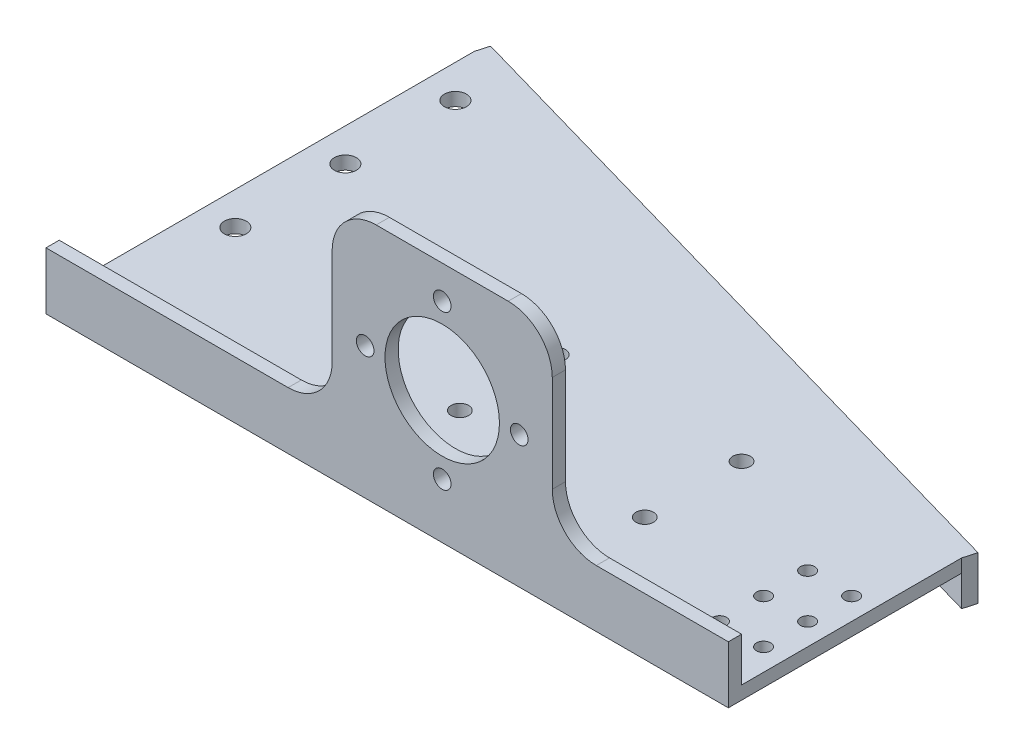
from build123d import *

# Parameters (mm, degrees)
EXTRUDE_1_DEPTH             = 3
HOLE_WIZARD_5_0_5_2_D       = 5
HOLE_WIZARD_3_2_3_2_2_D     = 3.2
PATTERN_LINEAR_1_COUNT      = 3
PATTERN_LINEAR_1_PITCH      = 10
PATTERN_LINEAR_1_COUNT_DIR2 = 2
PATTERN_LINEAR_1_PITCH_DIR2 = 10
EXTRUDE_2_DEPTH             = 10
SKETCH_9_W                  = 155
SKETCH_9_H                  = 3
EXTRUDE_3_DEPTH             = 13
SKETCH_10_W                 = 50
SKETCH_10_H                 = 3
EXTRUDE_4_DEPTH             = 55
SKETCH_12_R                 = 13
CUT_EXTRUDE_1_DEPTH         = 3
SKETCH_13_R                 = 2
CUT_EXTRUDE_2_DEPTH         = 3
PATTERN_CIRCULAR_1_COUNT    = 4
FILLET_1_R                  = 10
HOLE_WIZARD_4_0_4_2_D       = 4


with BuildPart() as part:
    # 草图1 → 凸台-拉伸1 (new body)
    with BuildSketch(Plane(origin=(0, 0, 0), x_dir=(1, 0, 0), z_dir=(0, 1, 0))):
        Polygon((-85, -45), (70, -45), (70, 5), (-70, 45), (-85, 45), align=None)
        Polygon((-85, 45), (-70, 45), (-85, 49.285714286), align=None)
    extrude(amount=EXTRUDE_1_DEPTH)

    # Ø5.0 (5) 直径孔2 (through all)
    with Locations(Plane(origin=(0, 3, 0), x_dir=(1, 0, 0), z_dir=(0, 1, 0))):
        with Locations((-77.5, -37.5), (-77.5, -12.5), (-77.5, 37.5), (-77.5, 12.5)):
            Hole(HOLE_WIZARD_5_0_5_2_D / 2)

    # Ø3.2 (3.2) 直径孔2 (through all)
    with Locations(Plane(origin=(0, 0, 0), x_dir=(-1, 0, 0), z_dir=(0, -1, 0))):
        with Locations((-65, -35)):
            hole_wizard_3_2_3_2_2 = Hole(HOLE_WIZARD_3_2_3_2_2_D / 2)

    # 阵列(线性)1: Hole Wizard 3.2 _3.2_ _2 3 × 2
    with Locations(*[(-j * PATTERN_LINEAR_1_PITCH_DIR2, 0, -i * PATTERN_LINEAR_1_PITCH) for i in range(PATTERN_LINEAR_1_COUNT) for j in range(PATTERN_LINEAR_1_COUNT_DIR2) if (i, j) != (0, 0)]):
        add(hole_wizard_3_2_3_2_2, mode=Mode.SUBTRACT)

    # 草图8 → 凸台-拉伸2 (add)
    with BuildSketch(Plane(origin=(0, 3, 0), x_dir=(1, 0, 0), z_dir=(0, 1, 0))):
        Polygon((-85, 49.285714286), (70, 5), (70.824163384, 7.884571843), (-84.175836616, 52.170286129), align=None)
    extrude(amount=-EXTRUDE_2_DEPTH)

    # 草图9 → 凸台-拉伸3 (add)
    with BuildSketch(Plane(origin=(0, 0, 0), x_dir=(-1, 0, 0), z_dir=(0, -1, 0))):
        with Locations((7.5, -46.5)):
            Rectangle(SKETCH_9_W, SKETCH_9_H)
    extrude(amount=-EXTRUDE_3_DEPTH)

    # 草图10 → 凸台-拉伸4 (add)
    with BuildSketch(Plane.XZ):
        with Locations((5, 46.5)):
            Rectangle(SKETCH_10_W, SKETCH_10_H)
    extrude(amount=-EXTRUDE_4_DEPTH)

    # 草图12 → 切除-拉伸1 (cut)
    with BuildSketch(Plane.XY.offset(48)):
        with Locations((5, 30)):
            Circle(SKETCH_12_R)
    extrude(amount=-CUT_EXTRUDE_1_DEPTH, mode=Mode.SUBTRACT)

    # 草图13 → 切除-拉伸2 (cut)
    with BuildSketch(Plane.XY.offset(48)):
        with Locations((5, 47.5)):
            Circle(SKETCH_13_R)
    cut_extrude_2 = extrude(amount=-CUT_EXTRUDE_2_DEPTH, mode=Mode.SUBTRACT)

    # 阵列(圆周)1: 切除-拉伸2 ×4 about axis
    pattern_circular_1_axis = Axis((5, 30, 0), (0, 0, 1))
    for i in range(1, PATTERN_CIRCULAR_1_COUNT):
        add(cut_extrude_2.rotate(pattern_circular_1_axis, i * 360 / PATTERN_CIRCULAR_1_COUNT), mode=Mode.SUBTRACT)

    # 圆角1
    fillet_1_edges = [part.edges().sort_by_distance(p)[0] for p in [
        (-20, 13, 46.5),
        (30, 13, 46.5),
        (30, 55, 46.5),
        (-20, 55, 46.5),
    ]]
    fillet(fillet_1_edges, radius=FILLET_1_R)

    # Ø4.0 (4) 直径孔2 (through all)
    with Locations(Plane(origin=(0, 3, 0), x_dir=(1, 0, 0), z_dir=(0, 1, 0))):
        with Locations((-16, -1), (-16, -23), (26, -23), (26, -1)):
            Hole(HOLE_WIZARD_4_0_4_2_D / 2)


solid = part.part
